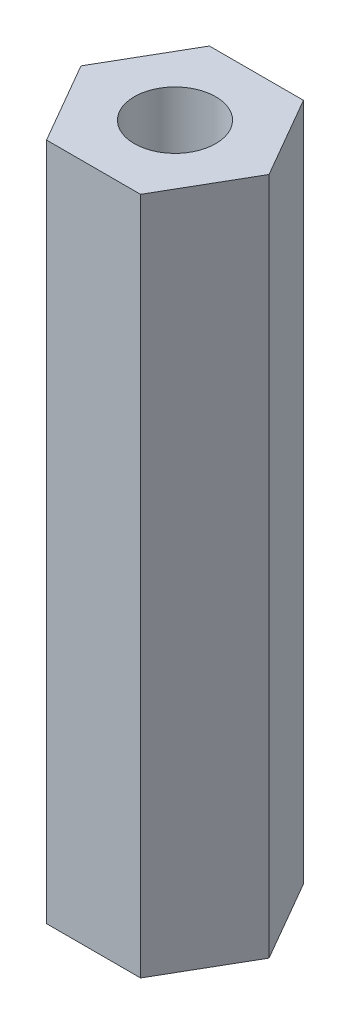
from build123d import *

# Parameters (mm, degrees)
BOSS_EXTRUDE1_DEPTH = 25
SKETCH2_R           = 1.5
CUT_EXTRUDE1_DEPTH  = 25


with BuildPart() as part:
    # Sketch1 → Boss-Extrude1 (new body)
    with BuildSketch(Plane(origin=(0, 0, 0), x_dir=(1, 0, 0), z_dir=(0, 1, 0))):
        Polygon((-3.464101615, 0), (-1.732050808, -3), (1.732050808, -3), (3.464101615, 0), (1.732050808, 3), (-1.732050808, 3), align=None)
    extrude(amount=BOSS_EXTRUDE1_DEPTH)

    # Sketch2 → Cut-Extrude1 (cut)
    with BuildSketch(Plane(origin=(0, 25, 0), x_dir=(1, 0, 0), z_dir=(0, 1, 0))):
        with Locations(Location((0, 0, 0), (0, 0, 270))):
            Circle(SKETCH2_R)
    extrude(amount=-CUT_EXTRUDE1_DEPTH, mode=Mode.SUBTRACT)


solid = part.part
